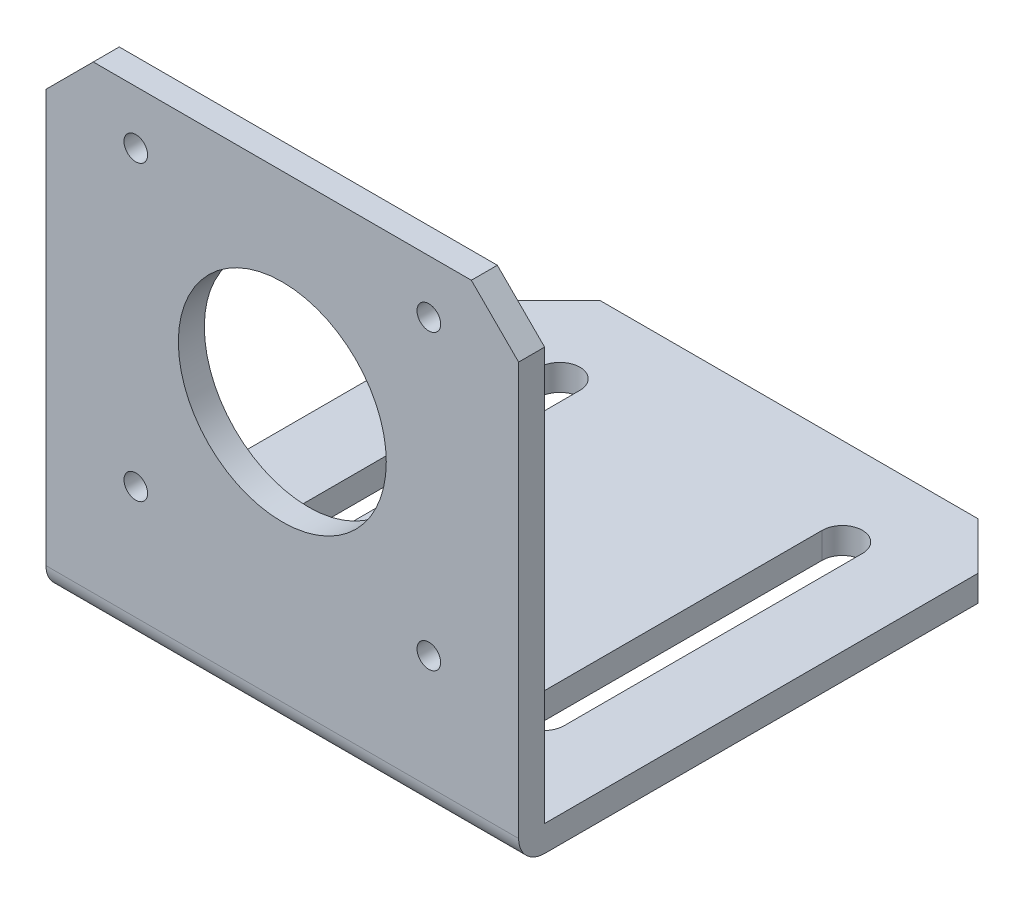
from build123d import *

# Parameters (mm, degrees)
BOSS_EXTRUDE1_DEPTH = 25
SKETCH5_R           = 1.25
SKETCH5_R_2         = 11
CUT_EXTRUDE1_DEPTH  = 67.430584071
CUT_EXTRUDE2_DEPTH  = 77.502826745
CHAMFER1_SIZE       = 5


with BuildPart() as part:
    # Sketch4 → Boss-Extrude1 (new, symmetric)
    with BuildSketch(Plane(origin=(0, 0, 0), x_dir=(0, 0, -1), z_dir=(1, 0, 0))):
        with BuildLine():
            Line((0, 21.15), (0, -27.5))
            Line((0, -27.5), (50.85, -27.5))
            Line((50.85, -27.5), (50.85, -30.25))
            Line((50.85, -30.25), (0, -30.25))
            ThreePointArc((0, -30.25), (-1.944543648, -29.444543648), (-2.75, -27.5))
            Line((-2.75, -27.5), (-2.75, 21.15))
            Line((-2.75, 21.15), (0, 21.15))
        make_face()
    extrude(amount=BOSS_EXTRUDE1_DEPTH, both=True)

    # Sketch5 → Cut-Extrude1 (cut, through all)
    with BuildSketch(Plane.XY.offset(2.75)):
        with Locations((-15.5, -15.5)):
            Circle(SKETCH5_R)
        with Locations((-15.5, 15.5)):
            Circle(SKETCH5_R)
        with Locations((15.5, 15.5)):
            Circle(SKETCH5_R)
        with Locations((15.5, -15.5)):
            Circle(SKETCH5_R)
        Circle(SKETCH5_R_2)
    extrude(amount=-CUT_EXTRUDE1_DEPTH, mode=Mode.SUBTRACT)

    # Sketch6 → Cut-Extrude2 (cut, through all)
    with BuildSketch(Plane.XZ.offset(30.25)):
        with BuildLine():
            Line((-12.82, -9.995), (-12.82, -41.55))
            ThreePointArc((-12.82, -41.55), (-14.945, -43.675), (-17.07, -41.55))
            Line((-17.07, -41.55), (-17.07, -9.995))
            ThreePointArc((-17.07, -9.995), (-14.945, -7.87), (-12.82, -9.995))
        make_face()
        with BuildLine():
            Line((12.82, -9.995), (12.82, -41.55))
            ThreePointArc((12.82, -41.55), (14.945, -43.675), (17.07, -41.55))
            Line((17.07, -41.55), (17.07, -9.995))
            ThreePointArc((17.07, -9.995), (14.945, -7.87), (12.82, -9.995))
        make_face()
    extrude(amount=-CUT_EXTRUDE2_DEPTH, mode=Mode.SUBTRACT)

    # Chamfer1
    chamfer1_edges = [part.edges().sort_by_distance(p)[0] for p in [
        (25, -28.875, -50.85),
        (25, 21.15, 1.375),
        (-25, -28.875, -50.85),
        (-25, 21.15, 1.375),
    ]]
    chamfer(chamfer1_edges, length=CHAMFER1_SIZE)


solid = part.part
